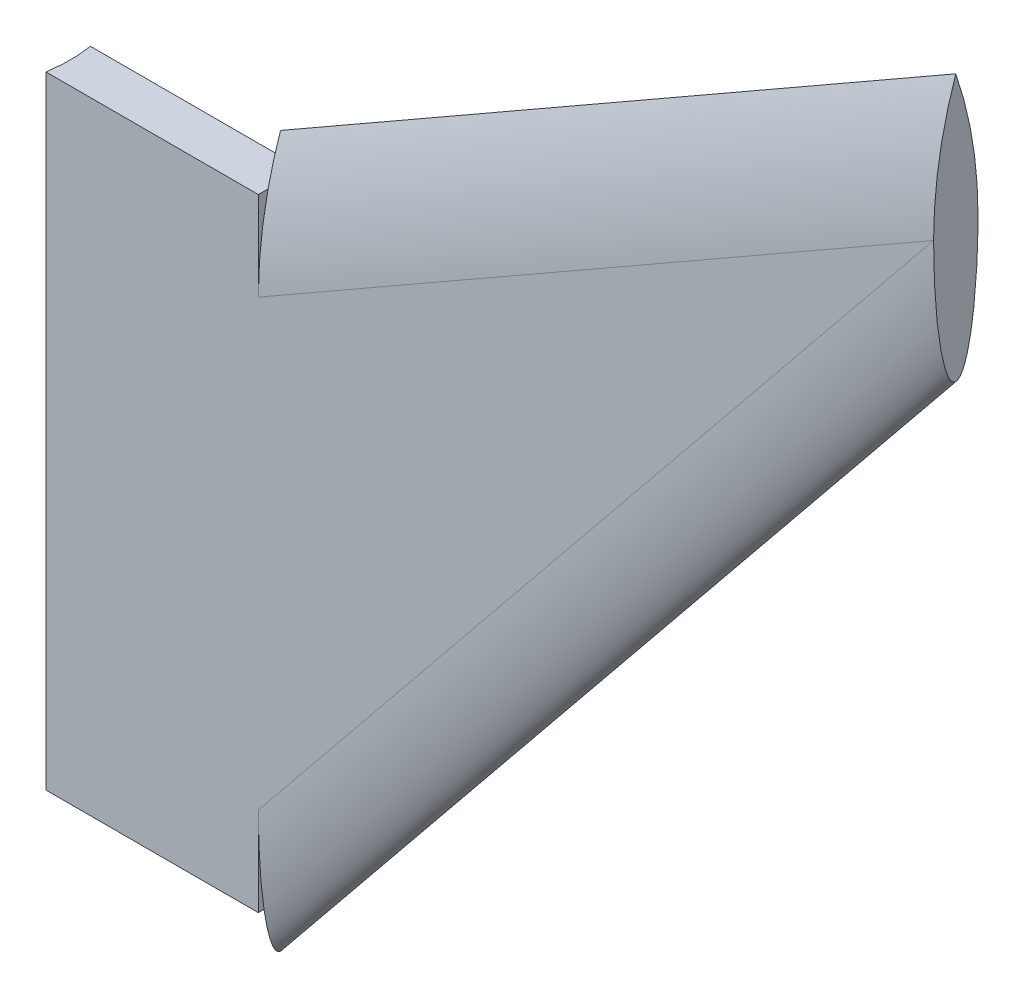
from build123d import *

# Parameters (mm, degrees)
BOSS_EXTRUDE1_DEPTH = 5
CUT_EXTRUDE2_DEPTH  = 120.505652991
CUT_EXTRUDE3_DEPTH  = 87.577477123
SKETCH6_R           = 15.9
CUT_EXTRUDE7_DEPTH  = 126.900754709


with BuildPart() as part:
    # Sketch1 → Boss-Extrude1 (new body)
    with BuildSketch(Plane.XY):
        Polygon((0, 0), (0, 70), (25, 70), (25, 75), (101, 118.517979035), (101, 88.517979035), (25, -5), (25, 0), align=None)
    extrude(amount=BOSS_EXTRUDE1_DEPTH)

    # Sketch4 → Cut-Extrude2 (cut, along a direction that is not the sketch's normal)
    with BuildSketch(Plane(origin=(101, 0, 0), x_dir=(0, 0, -1), z_dir=(1, 0, 0))):
        with BuildLine():
            Line((0, 88.517979035), (0, 103.517979035))
            add(Edge.make_bspline(
                [(-2.5, 88.517979035), (0, 88.517979035), (0, 103.517979035)],
                knots=[6.283185307, 6.283185307, 6.283185307, 7.853981634, 7.853981634, 7.853981634], degree=2, weights=[1, 0.707106781, 1]))
            Line((-2.5, 88.517979035), (0, 88.517979035))
        make_face()
        with BuildLine():
            add(Edge.make_bspline(
                [(-5, 103.517979035), (-5, 88.517979035), (-2.5, 88.517979035)],
                knots=[4.71238898, 4.71238898, 4.71238898, 6.283185307, 6.283185307, 6.283185307], degree=2, weights=[1, 0.707106781, 1]))
            Line((-5, 103.517979035), (-5, 88.517979035))
            Line((-5, 88.517979035), (-2.5, 88.517979035))
        make_face()
    extrude(amount=-CUT_EXTRUDE2_DEPTH, dir=(0.6306758074312901, 0.7760464070665428, 0), mode=Mode.SUBTRACT)

    # Sketch5 → Cut-Extrude3 (cut, along a direction that is not the sketch's normal)
    with BuildSketch(Plane(origin=(101, 0, 0), x_dir=(0, 0, -1), z_dir=(1, 0, 0))):
        with BuildLine():
            ThreePointArc((-2.5, 118.517979035), (-0.629281023, 111.121432198), (0, 103.517979035))
            Line((0, 103.517979035), (0, 118.517979035))
            Line((0, 118.517979035), (-2.5, 118.517979035))
        make_face()
        with BuildLine():
            Line((-5, 118.517979035), (-5, 103.517979035))
            ThreePointArc((-5, 103.517979035), (-4.370718977, 111.121432198), (-2.5, 118.517979035))
            Line((-2.5, 118.517979035), (-5, 118.517979035))
        make_face()
    extrude(amount=-CUT_EXTRUDE3_DEPTH, dir=(0.8678030299169633, 0.4969083429234592, 0), mode=Mode.SUBTRACT)

    # Sketch6 → Cut-Extrude7 (cut, through all)
    with BuildSketch(Plane(origin=(0, 70, 0), x_dir=(1, 0, 0), z_dir=(0, 1, 0))):
        with Locations((-14.6, -2.5)):
            Circle(SKETCH6_R)
    extrude(amount=-CUT_EXTRUDE7_DEPTH, mode=Mode.SUBTRACT)


solid = part.part
